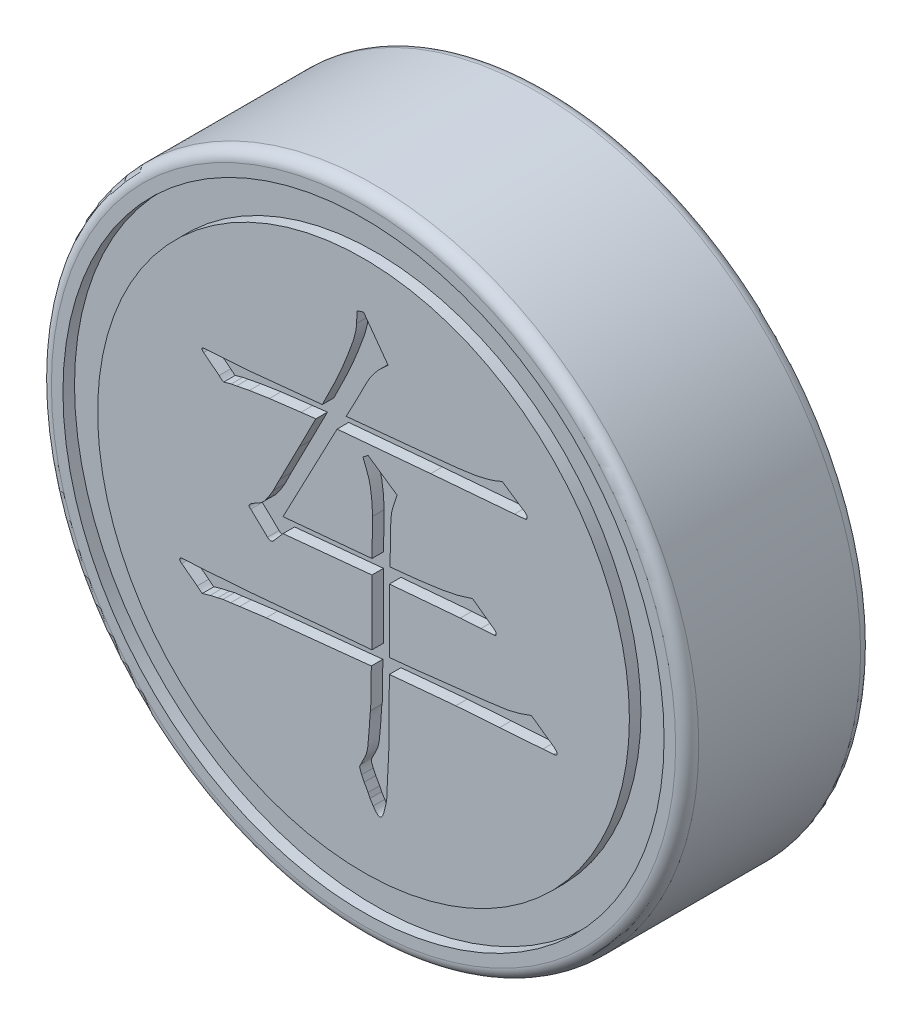
from build123d import *

# Parameters (mm, degrees)
SKETCH_1_R          = 14
EXTRUDE_1_DEPTH     = 8
SKETCH_2_R          = 13
SKETCH_2_R_2        = 11.5
CUT_EXTRUDE_1_DEPTH = 0.5
SKETCH_3_R          = 5.1
CUT_EXTRUDE_2_DEPTH = 5
CHAMFER_1_SIZE      = 0.5
FILLET_1_R          = 0.5
CUT_EXTRUDE_3_DEPTH = 0.5


with BuildPart() as part:
    # 草图1 → 凸台-拉伸1 (new body)
    with BuildSketch(Plane.XY):
        Circle(SKETCH_1_R)
    extrude(amount=EXTRUDE_1_DEPTH)

    # 草图2 → 切除-拉伸1 (cut)
    with BuildSketch(Plane.XY.offset(8)):
        Circle(SKETCH_2_R)
        Circle(SKETCH_2_R_2, mode=Mode.SUBTRACT)
    extrude(amount=-CUT_EXTRUDE_1_DEPTH, mode=Mode.SUBTRACT)

    # 草图3 → 切除-拉伸2 (cut)
    with BuildSketch(Plane(origin=(0, 0, 0), x_dir=(-1, 0, 0), z_dir=(0, 0, -1))):
        Circle(SKETCH_3_R)
    extrude(amount=-CUT_EXTRUDE_2_DEPTH, mode=Mode.SUBTRACT)

    # 倒角1
    chamfer_1_edges = [part.edges().sort_by_distance(p)[0] for p in [
        (5.1, 0, 0),
    ]]
    chamfer(chamfer_1_edges, length=CHAMFER_1_SIZE)

    # 圆角1
    fillet_1_edges = [part.edges().sort_by_distance(p)[0] for p in [
        (-14, 0, 0),
        (-14, 0, 8),
    ]]
    fillet(fillet_1_edges, radius=FILLET_1_R)

    # 草图4 → 切除-拉伸3 (cut)
    with BuildSketch(Plane.XY.offset(8)):
        with BuildLine():
            Line((0.364999352, -2.980218411), (0.364999352, -0.176894311))
            Line((0.364999352, -0.176894311), (-3.482646078, -0.55085553))
            Line((-3.482646078, -0.55085553), (-3.903698709, -1.035620073))
            add(Edge.make_bspline(
                [(-3.903698709, -1.035620073), (-3.921949626, -1.051521945), (-3.955318938, -1.080596347), (-4.02385356, -1.093601294), (-4.093485182, -1.070955138), (-4.131998774, -1.037336832), (-4.153006188, -1.018999575)],
                knots=[0, 0, 0, 0, 1.010210636, 1.847032314, 2.825653989, 4, 4, 4, 4], degree=3))
            Line((-4.153006188, -1.018999575), (-4.878767961, -0.326478799))
            add(Edge.make_bspline(
                [(-4.878767961, -0.326478799), (-4.901162646, -0.31161545), (-4.938138664, -0.287074473), (-4.956009478, -0.220149805), (-4.916955445, -0.166933863), (-4.854200877, -0.109166524), (-4.740621788, -0.038480568), (-4.578751651, 0.041246513), (-4.396995108, 0.147612927), (-4.267815266, 0.281631999), (-4.177574041, 0.413167615), (-4.095245986, 0.535344444), (-4.003348342, 0.684924492), (-3.938680704, 0.792573649), (-3.903698709, 0.85080652)],
                knots=[0, 0, 0, 0, 0.5665069, 0.935363432, 1.347272117, 1.899108522, 2.809018161, 4.214009276, 5.823434573, 7.337015916, 8.197422815, 9.279307456, 10.52823987, 12, 12, 12, 12], degree=3))
            Line((-3.903698709, 0.85080652), (-3.623920316, 1.413133389))
            Line((-3.623920316, 1.413133389), (-2.787355219, 3.039172171))
            Line((-2.787355219, 3.039172171), (-2.061593446, 4.460224802))
            Line((-2.061593446, 4.460224802), (-2.701482643, 4.385432558))
            Line((-2.701482643, 4.385432558), (-4.069903695, 4.216457489))
            Line((-4.069903695, 4.216457489), (-4.934169623, 4.086263583))
            Line((-4.934169623, 4.086263583), (-5.49372641, 3.975460259))
            Line((-5.49372641, 3.975460259), (-5.715333058, 3.936679096))
            Line((-5.715333058, 3.936679096), (-6.050513114, 3.84249627))
            add(Edge.make_bspline(
                [(-6.050513114, 3.84249627), (-6.058112615, 3.844891362), (-6.081548402, 3.852277485), (-6.116322482, 3.888483025), (-6.178233621, 3.928996566), (-6.220182518, 3.968979944), (-6.244418931, 3.992080758)],
                knots=[0, 0, 0, 0, 0.384544412, 1.185880507, 2.374113107, 4, 4, 4, 4], degree=3))
            Line((-6.244418931, 3.992080758), (-6.914779042, 4.515626464))
            add(Edge.make_bspline(
                [(-6.914779042, 4.515626464), (-6.930002363, 4.529558047), (-6.958765162, 4.555880248), (-6.992812242, 4.60612474), (-6.966816462, 4.67567345), (-6.917892686, 4.681151317), (-6.887078211, 4.684601533)],
                knots=[0, 0, 0, 0, 0.989657917, 1.869850357, 2.658332393, 4, 4, 4, 4], degree=3))
            Line((-6.887078211, 4.684601533), (-6.050513114, 4.740003196))
            Line((-6.050513114, 4.740003196), (-4.961870454, 4.814795439))
            Line((-4.961870454, 4.814795439), (-1.781815053, 5.133354996))
            add(Edge.make_bspline(
                [(-1.781815053, 5.133354996), (-1.68064024, 5.33437948), (-1.487375091, 5.718378482), (-1.218776519, 6.272731401), (-0.993013424, 6.783135415), (-0.825709099, 7.177851989), (-0.712083154, 7.468344567), (-0.636577958, 7.66072434), (-0.573818238, 7.837208752), (-0.515296705, 7.992454281), (-0.467033232, 8.13092694), (-0.42909808, 8.251255689), (-0.398088345, 8.353639205), (-0.358730056, 8.503353573), (-0.31547353, 8.685972864), (-0.306449216, 8.844126394), (-0.302590676, 8.911748348)],
                knots=[0, 0, 0, 0, 2.31866266, 4.429132864, 6.345514893, 8.068137545, 8.845429607, 9.559172328, 10.197194533, 10.775076645, 11.268480125, 11.707738113, 12.074952089, 12.370320867, 13.303195525, 14, 14, 14, 14], degree=3))
            Line((-0.302590676, 8.911748348), (-0.274889845, 9.396512891))
            Line((-0.274889845, 9.396512891), (0.002118465, 9.490695716))
            Line((0.002118465, 9.490695716), (1.063060294, 8.030861921))
            add(Edge.make_bspline(
                [(1.063060294, 8.030861921), (1.001875294, 7.976662943), (0.886423198, 7.874393013), (0.725297641, 7.724119762), (0.591644608, 7.581348922), (0.443536324, 7.409232839), (0.293354313, 7.194182748), (0.192814594, 7.015971437), (0.143392704, 6.928368846)],
                knots=[0, 0, 0, 0, 1.018009254, 1.920916925, 2.742543874, 3.452256103, 4.747616159, 6, 6, 6, 6], degree=3))
            Line((0.143392704, 6.928368846), (-0.274889845, 6.105654165))
            Line((-0.274889845, 6.105654165), (-0.751344139, 5.20814724))
            Line((-0.751344139, 5.20814724), (2.514583839, 5.526706797))
            add(Edge.make_bspline(
                [(2.514583839, 5.526706797), (2.653111107, 5.538452904), (2.918253661, 5.560935069), (3.299574291, 5.597374595), (3.646850233, 5.632652564), (3.959748232, 5.668992616), (4.238462408, 5.703260729), (4.483831784, 5.730810314), (4.694789895, 5.76590035), (4.9283667, 5.80466465), (5.188909025, 5.860652125), (5.479618478, 5.940188801), (5.749095155, 6.033571135), (5.917623377, 6.108230493), (5.999348382, 6.144435328)],
                knots=[0, 0, 0, 0, 1.407234446, 2.693460587, 3.877374533, 4.940498354, 5.881856524, 6.720026905, 7.439163069, 8.046111896, 9.116687132, 10.134815288, 11.095509173, 12, 12, 12, 12], degree=3))
            Line((5.999348382, 6.144435328), (6.977187717, 5.487925633))
            add(Edge.make_bspline(
                [(6.977187717, 5.487925633), (7.008030124, 5.461120155), (7.062124609, 5.414106038), (7.084090428, 5.318301846), (7.050157912, 5.239307478), (7.001738027, 5.23149764), (6.977187717, 5.227537822)],
                knots=[0, 0, 0, 0, 1.374920256, 2.411472091, 3.194569486, 4, 4, 4, 4], degree=3))
            Line((6.977187717, 5.227537822), (6.531204338, 5.188756658))
            Line((6.531204338, 5.188756658), (2.905165557, 4.889587683))
            Line((2.905165557, 4.889587683), (-1.141925856, 4.535017046))
            add(Edge.make_bspline(
                [(-1.141925856, 4.535017046), (-1.155746063, 4.509146684), (-1.187865504, 4.44902157), (-1.243989043, 4.345992973), (-1.313038349, 4.215687022), (-1.395603689, 4.058433419), (-1.49274707, 3.874290212), (-1.607365493, 3.665304129), (-1.730394983, 3.426648294), (-1.870238878, 3.161864363), (-2.024733829, 2.870720979), (-2.190397153, 2.55139325), (-2.371476411, 2.206108227), (-2.567907932, 1.83483332), (-2.774113046, 1.434159523), (-3.001645998, 1.011112893), (-3.234012907, 0.556082667), (-3.398219963, 0.245795795), (-3.482646078, 0.086263583)],
                knots=[0, 0, 0, 0, 0.280058442, 0.650881731, 1.120238416, 1.688142252, 2.346798925, 3.108150336, 3.963909556, 4.910415949, 5.967383585, 7.111000634, 8.345361656, 9.690180999, 11.121656849, 12.647979877, 14.276578114, 16, 16, 16, 16], degree=3))
            Line((-3.482646078, 0.086263583), (0.364999352, 0.44083422))
            Line((0.364999352, 0.44083422), (0.392700183, 2.030861921))
            add(Edge.make_bspline(
                [(0.392700183, 2.030861921), (0.392758729, 2.0391734), (0.392954038, 2.066900305), (0.389315917, 2.124151916), (0.383180763, 2.214541804), (0.377250409, 2.381894916), (0.362539532, 2.618039519), (0.325377825, 2.901320201), (0.286817877, 3.159435565), (0.238181897, 3.354004301), (0.18658083, 3.507316676), (0.129976623, 3.653379842), (0.058260681, 3.839090551), (0.004094525, 3.975510108), (-0.025582366, 4.050252503)],
                knots=[0, 0, 0, 0, 0.143893016, 0.480023839, 0.992641733, 1.712817043, 3.379342952, 5.086780586, 6.65858366, 7.895571872, 8.552836949, 9.458532143, 10.607564788, 12, 12, 12, 12], degree=3))
            Line((-0.025582366, 4.050252503), (0.198794366, 4.216457489))
            Line((0.198794366, 4.216457489), (1.453642011, 3.357731727))
            add(Edge.make_bspline(
                [(1.453642011, 3.357731727), (1.427221117, 3.286831056), (1.378059805, 3.154906302), (1.317275973, 2.966712157), (1.266891606, 2.804593702), (1.227441065, 2.65813799), (1.201496854, 2.512691538), (1.186199931, 2.352461565), (1.174363344, 2.170464584), (1.174036327, 2.041042705), (1.173863618, 1.972690176)],
                knots=[0, 0, 0, 0, 1.275106685, 2.372588742, 3.332576135, 4.136588052, 4.927234276, 5.819215856, 6.848246424, 8, 8, 8, 8], degree=3))
            Line((1.173863618, 1.972690176), (1.146162787, 0.515626464))
            Line((1.146162787, 0.515626464), (2.401010432, 0.64582037))
            add(Edge.make_bspline(
                [(2.401010432, 0.64582037), (2.631243439, 0.672219548), (3.068134434, 0.722314725), (3.684892451, 0.827790176), (4.229991566, 0.949472054), (4.561506034, 1.061490672), (4.716799906, 1.113964414)],
                knots=[0, 0, 0, 0, 1.174050682, 2.227882867, 3.169873544, 4, 4, 4, 4], degree=3))
            Line((4.716799906, 1.113964414), (5.694639241, 0.402053057))
            add(Edge.make_bspline(
                [(5.694639241, 0.402053057), (5.710178307, 0.383706862), (5.739891396, 0.34862611), (5.741376588, 0.28354122), (5.717749605, 0.227637414), (5.68319453, 0.220034303), (5.66693841, 0.216457489)],
                knots=[0, 0, 0, 0, 1.193552686, 2.282256672, 3.191903355, 4, 4, 4, 4], degree=3))
            Line((5.66693841, 0.216457489), (5.079680792, 0.177676326))
            Line((5.079680792, 0.177676326), (4.187714033, 0.122274664))
            Line((4.187714033, 0.122274664), (1.118461956, -0.138113148))
            Line((1.118461956, -0.138113148), (1.118461956, -2.888805669))
            Line((1.118461956, -2.888805669), (2.262506277, -2.775232262))
            Line((2.262506277, -2.775232262), (3.714029823, -2.606257192))
            add(Edge.make_bspline(
                [(3.714029823, -2.606257192), (3.86267669, -2.589507427), (4.146088732, -2.557572107), (4.550707876, -2.514015497), (4.914521261, -2.472482673), (5.236606152, -2.433201617), (5.517500034, -2.400628022), (5.756688425, -2.370333052), (5.954108492, -2.342173219), (6.260814136, -2.30057873), (6.697940857, -2.203088803), (7.066458086, -2.063473847), (7.256966111, -1.991298744)],
                knots=[0, 0, 0, 0, 1.243640181, 2.371140471, 3.383352035, 4.287926655, 5.068721081, 5.734291071, 6.29231505, 6.726571668, 8.307774198, 10, 10, 10, 10], degree=3))
            Line((7.256966111, -1.991298744), (8.232035363, -2.681049436))
            add(Edge.make_bspline(
                [(8.232035363, -2.681049436), (8.256706805, -2.701646841), (8.300033908, -2.737819264), (8.348676655, -2.792885194), (8.377155846, -2.842712342), (8.373252083, -2.900754757), (8.321219915, -2.957998128), (8.264138014, -2.961582228), (8.232035363, -2.963597913)],
                knots=[0, 0, 0, 0, 1.345759957, 2.363375401, 3.091761135, 3.674572883, 4.692188327, 6, 6, 6, 6], degree=3))
            Line((8.232035363, -2.963597913), (7.758351152, -2.999608993))
            Line((7.758351152, -2.999608993), (5.888545058, -3.129802899))
            Line((5.888545058, -3.129802899), (3.991038133, -3.262766888))
            Line((3.991038133, -3.262766888), (1.118461956, -3.523154699))
            Line((1.118461956, -3.523154699), (1.090761125, -6.47883337))
            Line((1.090761125, -6.47883337), (1.035359463, -7.525924782))
            Line((1.035359463, -7.525924782), (1.007658632, -8.199054976))
            Line((1.007658632, -8.199054976), (0.979957801, -8.423431708))
            Line((0.979957801, -8.423431708), (0.924556138, -8.647808439))
            Line((0.924556138, -8.647808439), (0.869154476, -8.852794588))
            add(Edge.make_bspline(
                [(0.869154476, -8.852794588), (0.857280099, -8.885544214), (0.836490542, -8.942881974), (0.795492925, -9.014685879), (0.744472633, -9.058537175), (0.6824312, -9.068761106), (0.61995904, -9.040364641), (0.557462486, -8.984456322), (0.487418096, -8.902426575), (0.444392393, -8.834993818), (0.420401014, -8.797392926)],
                knots=[0, 0, 0, 0, 1.221471257, 2.138541224, 2.877444999, 3.500730572, 4.228899096, 5.19557572, 6.436236913, 8, 8, 8, 8], degree=3))
            Line((0.420401014, -8.797392926), (0.281896859, -8.589636694))
            Line((0.281896859, -8.589636694), (0.198794366, -8.404041126))
            Line((0.198794366, -8.404041126), (0.029819296, -8.104872151))
            Line((0.029819296, -8.104872151), (-0.080984028, -7.880495419))
            add(Edge.make_bspline(
                [(-0.080984028, -7.880495419), (-0.101416765, -7.828482536), (-0.133530432, -7.746735069), (-0.170378575, -7.644882849), (-0.155120525, -7.570575063), (-0.120742157, -7.50053628), (-0.075090656, -7.402309417), (0.017791948, -7.24170309), (0.127686313, -7.011161129), (0.18256757, -6.749675411), (0.205143394, -6.522339607), (0.225666978, -6.323029471), (0.24160035, -6.096683264), (0.253880288, -5.858360497), (0.265415103, -5.6373542), (0.280578381, -5.464174507), (0.288749461, -5.350921614), (0.304583461, -5.298696003), (0.30959769, -5.282157469)],
                knots=[0, 0, 0, 0, 1.007104503, 1.58284325, 1.867390029, 2.332734656, 2.974104417, 3.80024767, 5.644616217, 7.504023117, 8.532483921, 9.724881019, 11.08012938, 12.582376936, 13.985883817, 15.027600389, 15.692065565, 16, 16, 16, 16], degree=3))
            Line((0.30959769, -5.282157469), (0.337298521, -3.597946943))
            Line((0.337298521, -3.597946943), (-4.20840785, -4.066090987))
            Line((-4.20840785, -4.066090987), (-5.352452172, -4.215675475))
            Line((-5.352452172, -4.215675475), (-5.743033889, -4.271077137))
            Line((-5.743033889, -4.271077137), (-6.078213945, -4.3098583))
            Line((-6.078213945, -4.3098583), (-6.302590676, -4.365259962))
            Line((-6.302590676, -4.365259962), (-6.635000648, -4.440052206))
            Line((-6.635000648, -4.440052206), (-6.970180704, -4.534235032))
            add(Edge.make_bspline(
                [(-6.970180704, -4.534235032), (-6.978626261, -4.530788433), (-7.003721776, -4.520547054), (-7.047733317, -4.486215909), (-7.114397692, -4.434129752), (-7.165206755, -4.390476799), (-7.194557435, -4.365259962)],
                knots=[0, 0, 0, 0, 0.387199066, 1.150540979, 2.353963763, 4, 4, 4, 4], degree=3))
            Line((-7.194557435, -4.365259962), (-7.862147463, -3.861104838))
            add(Edge.make_bspline(
                [(-7.862147463, -3.861104838), (-7.885141053, -3.842858598), (-7.925046541, -3.811192159), (-7.95881235, -3.740459744), (-7.919136572, -3.666898643), (-7.866049895, -3.658404995), (-7.834446632, -3.653348605)],
                knots=[0, 0, 0, 0, 1.152221061, 1.999685271, 2.809183847, 4, 4, 4, 4], degree=3))
            Line((-7.834446632, -3.653348605), (-6.748574055, -3.597946943))
            Line((-6.748574055, -3.597946943), (-6.105914776, -3.542545281))
            Line((-6.105914776, -3.542545281), (-4.795665468, -3.448362455))
            Line((-4.795665468, -3.448362455), (-3.344141922, -3.31816855))
            Line((-3.344141922, -3.31816855), (-1.978490953, -3.187974644))
            Line((-1.978490953, -3.187974644), (0.364999352, -2.980218411))
        make_face()
    extrude(amount=-CUT_EXTRUDE_3_DEPTH, mode=Mode.SUBTRACT)


solid = part.part
